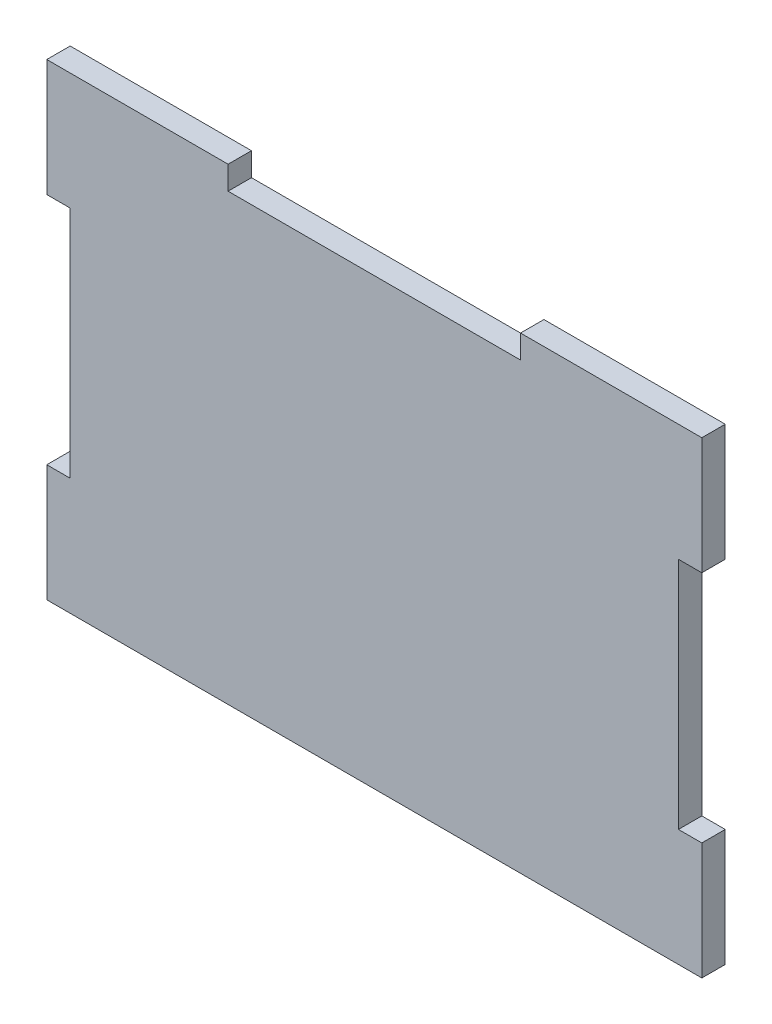
from build123d import *

# Parameters (mm, degrees)
SKETCH_1_W          = 112
SKETCH_1_H          = 80
EXTRUDE_1_DEPTH     = 4
SKETCH_2_W          = 4
SKETCH_2_H          = 40
SKETCH_2_W_2        = 50
SKETCH_2_H_2        = 4
CUT_EXTRUDE_1_DEPTH = 4


with BuildPart() as part:
    # 스케치1 → 보스-돌출1 (new body)
    with BuildSketch(Plane.XY):
        with Locations((52, 0)):
            Rectangle(SKETCH_1_W, SKETCH_1_H)
    extrude(amount=EXTRUDE_1_DEPTH)

    # 스케치2 → 컷-돌출1 (cut)
    with BuildSketch(Plane.XY.offset(4)):
        with Locations((-2, 0)):
            Rectangle(SKETCH_2_W, SKETCH_2_H)
        with Locations((52, 38)):
            Rectangle(SKETCH_2_W_2, SKETCH_2_H_2)
        with Locations((106, 0)):
            Rectangle(SKETCH_2_W, SKETCH_2_H)
    extrude(amount=-CUT_EXTRUDE_1_DEPTH, mode=Mode.SUBTRACT)


solid = part.part
